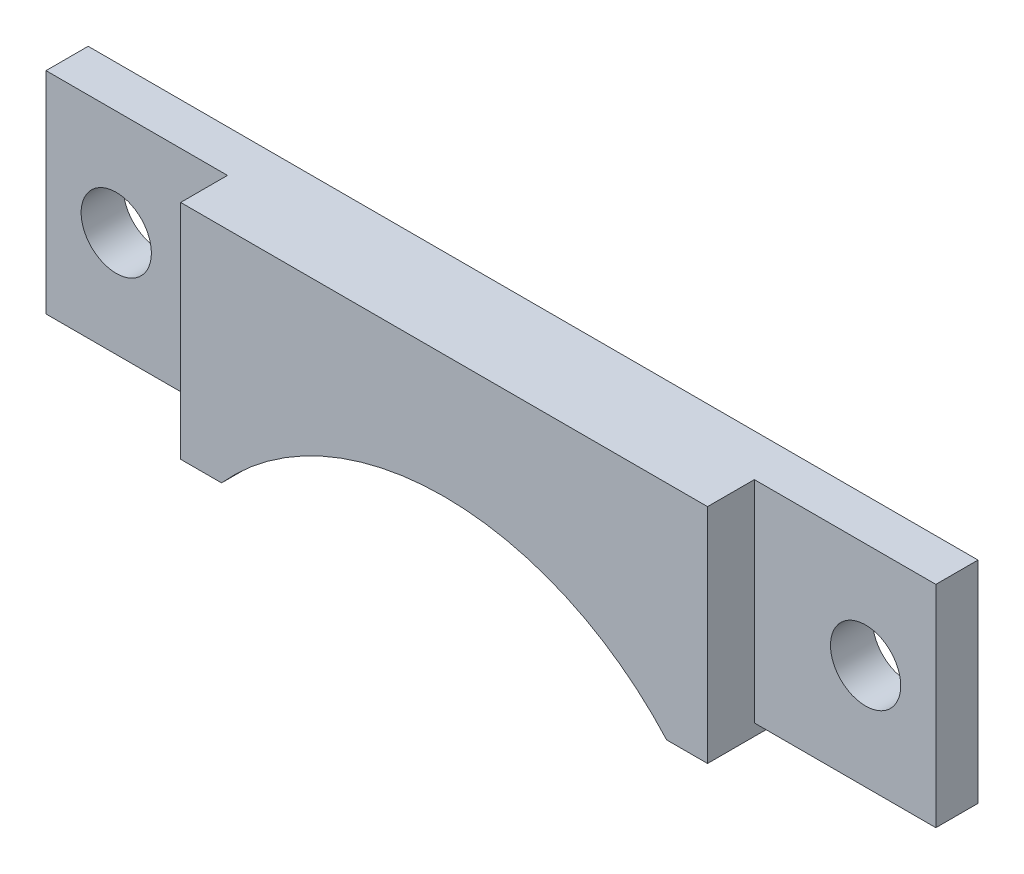
from build123d import *

# Parameters (mm, degrees)
SKETCH_1_R          = 1.5
EXTRUDE_1_DEPTH     = 1.8
EXTRUDE_2_DEPTH     = 2
SKETCH_3_W          = 7.75
SKETCH_3_H          = 0.5
CUT_EXTRUDE_1_DEPTH = 20.686607123


with BuildPart() as part:
    # 草图1 → 凸台-拉伸1 (new body)
    with BuildSketch(Plane.XY):
        with BuildLine():
            Line((-9.503288904, -4.75), (-19, -4.75))
            Line((-19, -4.75), (-19, 4.75))
            Line((-19, 4.75), (19, 4.75))
            Line((19, 4.75), (19, -4.75))
            Line((19, -4.75), (9.503288904, -4.75))
            ThreePointArc((9.503288904, -4.75), (0, -0.5), (-9.503288904, -4.75))
        make_face()
        with Locations((-16, 0.25)):
            Circle(SKETCH_1_R, mode=Mode.SUBTRACT)
        with Locations((16, 0.25)):
            Circle(SKETCH_1_R, mode=Mode.SUBTRACT)
    extrude(amount=EXTRUDE_1_DEPTH)

    # 草图2 → 凸台-拉伸2 (add)
    with BuildSketch(Plane.XY.offset(1.8)):
        with BuildLine():
            Line((-11.25, 4.75), (-11.25, -4.75))
            Line((-11.25, -4.75), (-9.503288904, -4.75))
            ThreePointArc((-9.503288904, -4.75), (0, -0.5), (9.503288904, -4.75))
            Line((9.503288904, -4.75), (11.25, -4.75))
            Line((11.25, -4.75), (11.25, 4.75))
            Line((11.25, 4.75), (-11.25, 4.75))
        make_face()
    extrude(amount=EXTRUDE_2_DEPTH)

    # 草图3 → 切除-拉伸1 (cut, through all)
    with BuildSketch(Plane.XY.offset(1.8)):
        with Locations((-15.125, -4.5)):
            Rectangle(SKETCH_3_W, SKETCH_3_H)
        with Locations((15.125, -4.5)):
            Rectangle(SKETCH_3_W, SKETCH_3_H)
    extrude(amount=-CUT_EXTRUDE_1_DEPTH, mode=Mode.SUBTRACT)


solid = part.part
